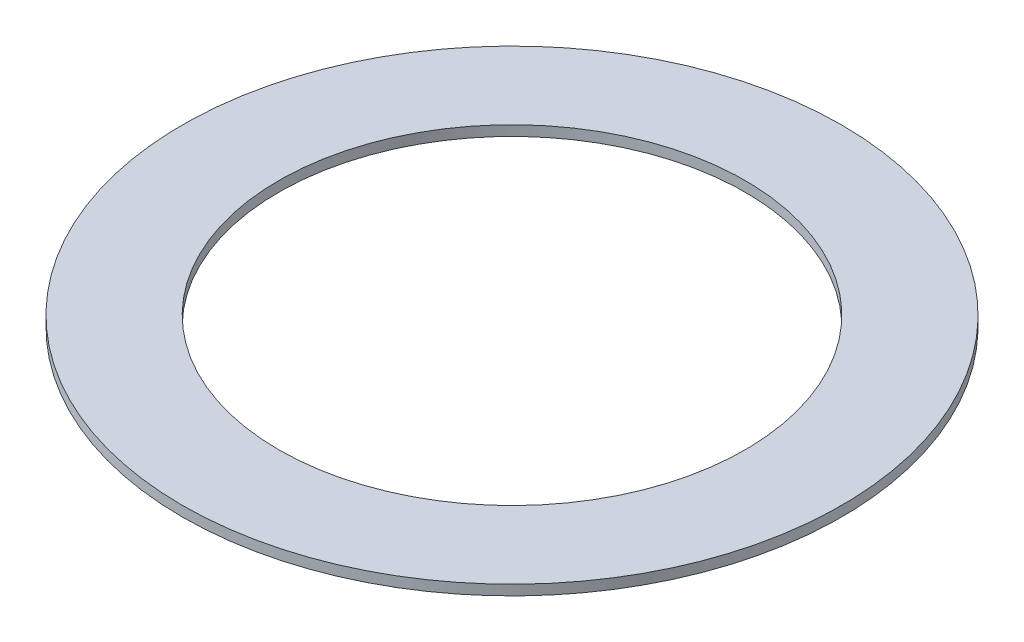
from build123d import *

# Parameters (mm, degrees)
SKETCH1_R      = 32.5
SKETCH1_R_2    = 23
EXTRUDE1_DEPTH = 1


with BuildPart() as part:
    # Sketch1 → Extrude1 (new body)
    with BuildSketch(Plane(origin=(0, 0, 0), x_dir=(1, 0, 0), z_dir=(0, 1, 0))):
        with Locations(Location((0, 0, 0), (0, 0, 270))):
            Circle(SKETCH1_R)
        with Locations(Location((0, 0, 0), (0, 0, 270))):
            Circle(SKETCH1_R_2, mode=Mode.SUBTRACT)
    extrude(amount=EXTRUDE1_DEPTH)


solid = part.part
